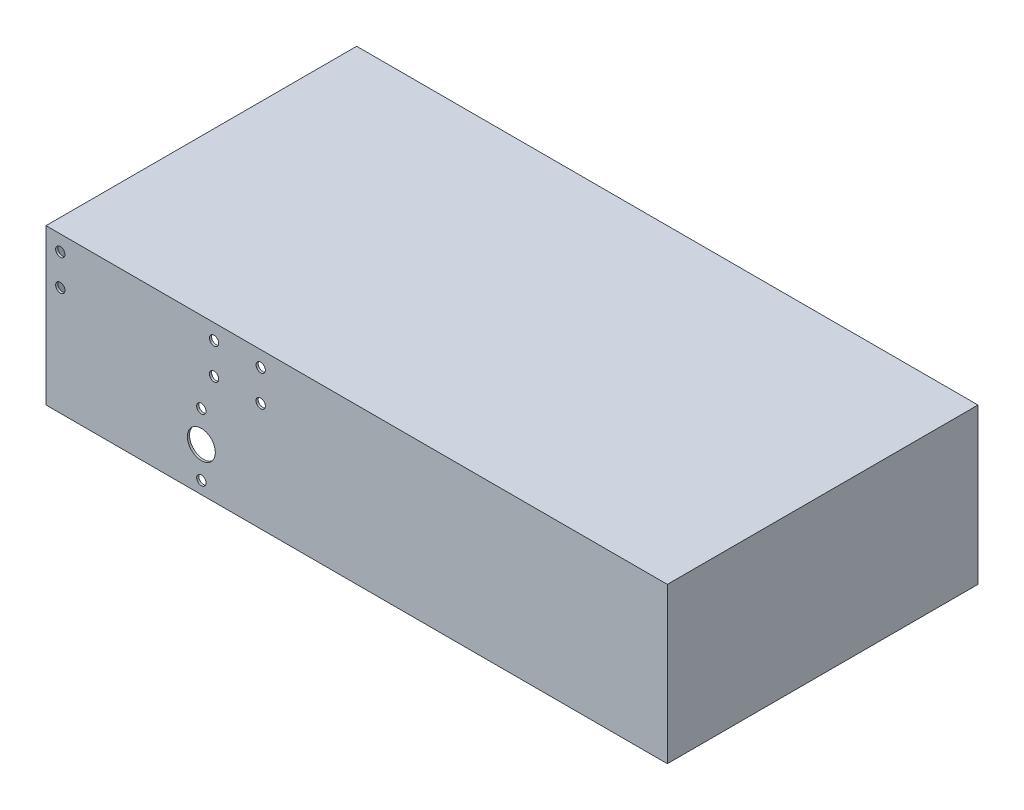
from build123d import *

# Parameters (mm, degrees)
SKETCH1_W           = 200
SKETCH1_H           = 100
BOSS_EXTRUDE1_DEPTH = 50
SKETCH3_W           = 198.6
SKETCH3_H           = 98.6
CUT_EXTRUDE1_DEPTH  = 49.3
SKETCH4_W           = 54.3
SKETCH4_H           = 98.6
BOSS_EXTRUDE2_DEPTH = 0.7
SKETCH2_R           = 4.5
SKETCH2_R_2         = 1.5
CUT_EXTRUDE2_DEPTH  = 230.128784748
SKETCH6_R           = 1.5
CUT_EXTRUDE3_DEPTH  = 0.7
SKETCH7_R           = 1.5
CUT_EXTRUDE4_DEPTH  = 0.7
CUT_EXTRUDE6_REACH  = 214.132
SKETCH8_R           = 1.21


with BuildPart() as part:
    # Sketch1 → Boss-Extrude1 (new body)
    with BuildSketch(Plane(origin=(0, 0, 0), x_dir=(1, 0, 0), z_dir=(0, 1, 0))):
        with Locations((100, 0)):
            Rectangle(SKETCH1_W, SKETCH1_H)
    extrude(amount=BOSS_EXTRUDE1_DEPTH)

    # Sketch3 → Cut-Extrude1 (cut)
    with BuildSketch(Plane.XZ):
        with Locations((100, 0)):
            Rectangle(SKETCH3_W, SKETCH3_H)
    extrude(amount=-CUT_EXTRUDE1_DEPTH, mode=Mode.SUBTRACT)

    # Sketch4 → Boss-Extrude2 (add)
    with BuildSketch(Plane.XZ):
        with Locations((172.15, 0)):
            Rectangle(SKETCH4_W, SKETCH4_H)
    extrude(amount=-BOSS_EXTRUDE2_DEPTH)

    # Sketch2 → Cut-Extrude2 (cut, through all)
    with BuildSketch(Plane.XY.offset(50)):
        with Locations((50, 14)):
            Circle(SKETCH2_R)
        with Locations((50, 4)):
            Circle(SKETCH2_R_2)
        with Locations((50, 24)):
            Circle(SKETCH2_R_2)
    extrude(amount=-CUT_EXTRUDE2_DEPTH, mode=Mode.SUBTRACT)

    # Sketch6 → Cut-Extrude3 (cut)
    with BuildSketch(Plane.XY.offset(50)):
        with Locations((4.6, 45)):
            Circle(SKETCH6_R)
        with Locations((4.6, 35)):
            Circle(SKETCH6_R)
        with Locations((54.1, 45)):
            Circle(SKETCH6_R)
        with Locations((54.1, 35)):
            Circle(SKETCH6_R)
        with Locations((69.1, 45)):
            Circle(SKETCH6_R)
        with Locations((69.1, 35)):
            Circle(SKETCH6_R)
    extrude(amount=-CUT_EXTRUDE3_DEPTH, mode=Mode.SUBTRACT)

    # Sketch7 → Cut-Extrude4 (cut)
    with BuildSketch(Plane.ZY):
        with Locations((42, 45)):
            Circle(SKETCH7_R)
        with Locations((42, 35)):
            Circle(SKETCH7_R)
    extrude(amount=-CUT_EXTRUDE4_DEPTH, mode=Mode.SUBTRACT)

    # Sketch8 → Cut-Extrude6 (cut, up to next)
    with BuildSketch(Plane.XZ, mode=Mode.PRIVATE) as cut_extrude6_sk1:
        with Locations(Location((160, 8.45, 0), (0, 0, 270))):
            Circle(SKETCH8_R)
    cut_extrude6_tool1 = extrude(cut_extrude6_sk1.sketch, amount=-CUT_EXTRUDE6_REACH, mode=Mode.PRIVATE) & part.part
    # Sketch8 → Cut-Extrude6 (cut, up to next)
    with BuildSketch(Plane.XZ, mode=Mode.PRIVATE) as cut_extrude6_sk2:
        with Locations(Location((160, -7.05, 0), (0, 0, 270))):
            Circle(SKETCH8_R)
    cut_extrude6_tool2 = extrude(cut_extrude6_sk2.sketch, amount=-CUT_EXTRUDE6_REACH, mode=Mode.PRIVATE) & part.part
    add(cut_extrude6_tool1.solids().sort_by_distance((160, 0, 8.45))[0], mode=Mode.SUBTRACT)
    add(cut_extrude6_tool2.solids().sort_by_distance((160, 0, -7.05))[0], mode=Mode.SUBTRACT)


solid = part.part
